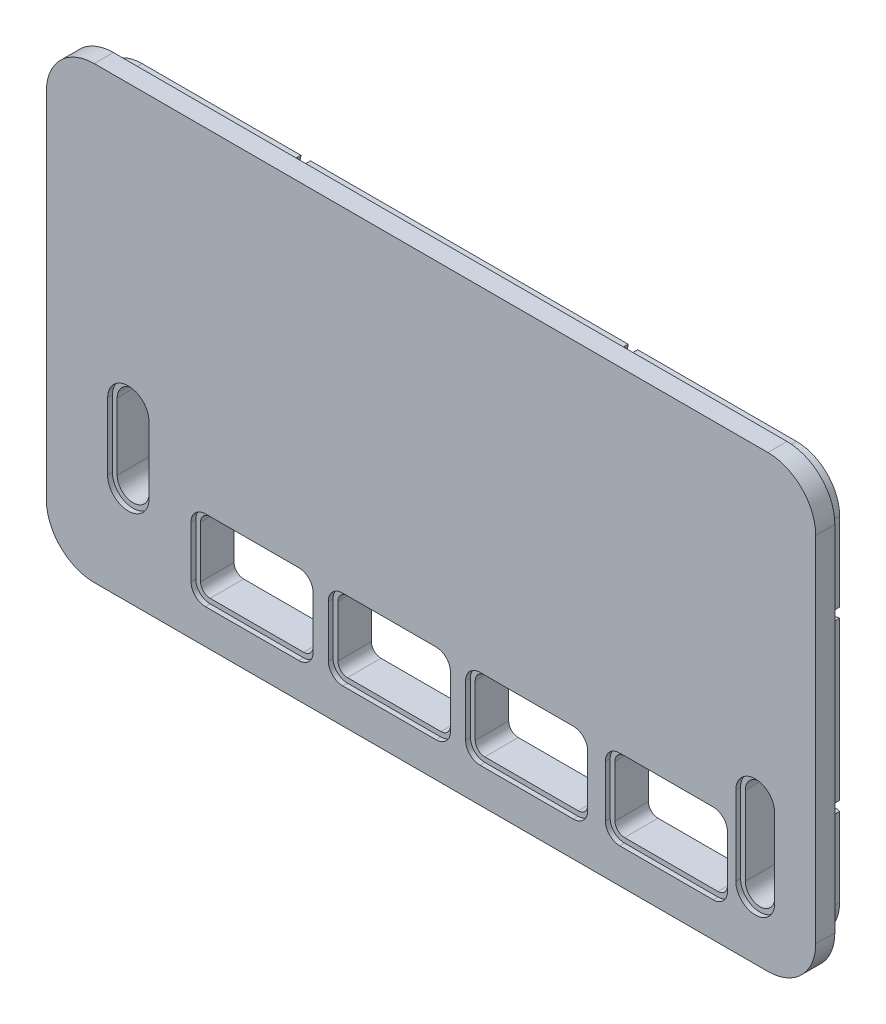
from build123d import *

# Parameters (mm, degrees)
EXTRUDE_1_DEPTH     = 2
EXTRUDE_2_DEPTH     = 2
CUT_EXTRUDE_2_DEPTH = 4
CUT_EXTRUDE_3_DEPTH = 0.5


with BuildPart() as part:
    # 草图1 → 凸台-拉伸1 (new body)
    with BuildSketch(Plane.XY.offset(994.761746566)):
        with BuildLine():
            Line((-36.977217365, -23.153037779), (-20.375793692, -23.153037779))
            ThreePointArc((-20.375793692, -23.153037779), (-20.507759703, -22.594020785), (-20.875793692, -22.153037779))
            Line((-20.875793692, -22.153037779), (-18.875793692, -22.153037779))
            ThreePointArc((-18.875793692, -22.153037779), (-19.243827681, -22.594020785), (-19.375793692, -23.153037779))
            Line((-19.375793692, -23.153037779), (13.827053654, -23.153037779))
            ThreePointArc((13.827053654, -23.153037779), (13.695087643, -22.594020785), (13.327053654, -22.153037779))
            Line((13.327053654, -22.153037779), (15.327053654, -22.153037779))
            ThreePointArc((15.327053654, -22.153037779), (14.959019666, -22.594020785), (14.827053654, -23.153037779))
            Line((14.827053654, -23.153037779), (31.428477328, -23.153037779))
            ThreePointArc((31.428477328, -23.153037779), (34.610457843, -21.835018294), (35.928477328, -18.653037779))
            Line((35.928477328, -18.653037779), (35.928477328, -10.409369377))
            ThreePointArc((35.928477328, -10.409369377), (35.356461327, -10.413320038), (35.071587729, -10.909369377))
            Line((35.071587729, -10.909369377), (35.071587729, -8.909369377))
            ThreePointArc((35.071587729, -8.909369377), (35.432427989, -9.275228629), (35.928477328, -9.409369377))
            Line((35.928477328, -9.409369377), (35.928477328, 7.077967428))
            ThreePointArc((35.928477328, 7.077967428), (35.432427989, 6.943826681), (35.071587729, 6.577967428))
            Line((35.071587729, 6.577967428), (35.071587729, 8.577967428))
            ThreePointArc((35.071587729, 8.577967428), (35.356461327, 8.08191809), (35.928477328, 8.077967428))
            Line((35.928477328, 8.077967428), (35.928477328, 16.32163583))
            ThreePointArc((35.928477328, 16.32163583), (34.610457843, 19.503616346), (31.428477328, 20.82163583))
            Line((31.428477328, 20.82163583), (14.827053654, 20.82163583))
            ThreePointArc((14.827053654, 20.82163583), (14.959019666, 20.262618836), (15.327053654, 19.82163583))
            Line((15.327053654, 19.82163583), (13.327053654, 19.82163583))
            ThreePointArc((13.327053654, 19.82163583), (13.695087643, 20.262618836), (13.827053654, 20.82163583))
            Line((13.827053654, 20.82163583), (-19.375793692, 20.82163583))
            ThreePointArc((-19.375793692, 20.82163583), (-19.243827681, 20.262618836), (-18.875793692, 19.82163583))
            Line((-18.875793692, 19.82163583), (-20.875793692, 19.82163583))
            ThreePointArc((-20.875793692, 19.82163583), (-20.507759703, 20.262618836), (-20.375793692, 20.82163583))
            Line((-20.375793692, 20.82163583), (-36.977217365, 20.82163583))
            ThreePointArc((-36.977217365, 20.82163583), (-40.15919788, 19.503616346), (-41.477217365, 16.32163583))
            Line((-41.477217365, 16.32163583), (-41.477217365, 8.077967428))
            ThreePointArc((-41.477217365, 8.077967428), (-40.905201365, 8.08191809), (-40.620327767, 8.577967428))
            Line((-40.620327767, 8.577967428), (-40.620327767, 6.577967428))
            ThreePointArc((-40.620327767, 6.577967428), (-40.981168027, 6.943826681), (-41.477217365, 7.077967428))
            Line((-41.477217365, 7.077967428), (-41.477217365, -9.409369377))
            ThreePointArc((-41.477217365, -9.409369377), (-40.981168027, -9.275228629), (-40.620327767, -8.909369377))
            Line((-40.620327767, -8.909369377), (-40.620327767, -10.909369377))
            ThreePointArc((-40.620327767, -10.909369377), (-40.905201365, -10.413320038), (-41.477217365, -10.409369377))
            Line((-41.477217365, -10.409369377), (-41.477217365, -18.653037779))
            ThreePointArc((-41.477217365, -18.653037779), (-40.15919788, -21.835018294), (-36.977217365, -23.153037779))
        make_face()
    extrude(amount=EXTRUDE_1_DEPTH)

    # 草图2 → 凸台-拉伸2 (add)
    with BuildSketch(Plane.XY.offset(996.761746566)):
        with BuildLine():
            Line((-42.977217365, 17.32163583), (-42.977217365, -19.653037779))
            ThreePointArc((-42.977217365, -19.653037779), (-41.512751271, -23.188571685), (-37.977217365, -24.653037779))
            Line((-37.977217365, -24.653037779), (32.428477328, -24.653037779))
            ThreePointArc((32.428477328, -24.653037779), (35.964011233, -23.188571685), (37.428477328, -19.653037779))
            Line((37.428477328, -19.653037779), (37.428477328, 17.32163583))
            ThreePointArc((37.428477328, 17.32163583), (35.964011233, 20.857169736), (32.428477328, 22.32163583))
            Line((32.428477328, 22.32163583), (-37.977217365, 22.32163583))
            ThreePointArc((-37.977217365, 22.32163583), (-41.512751271, 20.857169736), (-42.977217365, 17.32163583))
        make_face()
    extrude(amount=EXTRUDE_2_DEPTH)

    # 草图3 → 切除-拉伸2 (cut)
    with BuildSketch(Plane.XY.offset(998.761746566)):
        with BuildLine():
            Line((-24.489796203, -20.520829455), (-18.469872403, -20.520829455))
            Line((-18.469872403, -20.520829455), (-16.599885103, -20.520829455))
            ThreePointArc((-16.599885103, -20.520829455), (-15.892778322, -20.227936236), (-15.599885103, -19.520829455))
            Line((-15.599885103, -19.520829455), (-15.599885103, -14.120887455))
            ThreePointArc((-15.599885103, -14.120887455), (-15.892778322, -13.413780673), (-16.599885103, -13.120887455))
            Line((-16.599885103, -13.120887455), (-26.359783503, -13.120887455))
            ThreePointArc((-26.359783503, -13.120887455), (-27.066890284, -13.413780673), (-27.359783503, -14.120887455))
            Line((-27.359783503, -14.120887455), (-27.359783503, -19.520829455))
            ThreePointArc((-27.359783503, -19.520829455), (-27.066890284, -20.227936236), (-26.359783503, -20.520829455))
            Line((-26.359783503, -20.520829455), (-24.489796203, -20.520829455))
        make_face()
        with BuildLine():
            Line((-10.138767501, -20.520829455), (-4.118843701, -20.520829455))
            Line((-4.118843701, -20.520829455), (-2.248856401, -20.520829455))
            ThreePointArc((-2.248856401, -20.520829455), (-1.54174962, -20.227936236), (-1.248856401, -19.520829455))
            Line((-1.248856401, -19.520829455), (-1.248856401, -14.120887455))
            ThreePointArc((-1.248856401, -14.120887455), (-1.54174962, -13.413780673), (-2.248856401, -13.120887455))
            Line((-2.248856401, -13.120887455), (-12.008754801, -13.120887455))
            ThreePointArc((-12.008754801, -13.120887455), (-12.715861582, -13.413780673), (-13.008754801, -14.120887455))
            Line((-13.008754801, -14.120887455), (-13.008754801, -19.520829455))
            ThreePointArc((-13.008754801, -19.520829455), (-12.715861582, -20.227936236), (-12.008754801, -20.520829455))
            Line((-12.008754801, -20.520829455), (-10.138767501, -20.520829455))
        make_face()
        with BuildLine():
            Line((4.212261201, -20.520829455), (10.232185001, -20.520829455))
            Line((10.232185001, -20.520829455), (12.102172301, -20.520829455))
            ThreePointArc((12.102172301, -20.520829455), (12.809279082, -20.227936236), (13.102172301, -19.520829455))
            Line((13.102172301, -19.520829455), (13.102172301, -14.120887455))
            ThreePointArc((13.102172301, -14.120887455), (12.809279082, -13.413780673), (12.102172301, -13.120887455))
            Line((12.102172301, -13.120887455), (2.342273901, -13.120887455))
            ThreePointArc((2.342273901, -13.120887455), (1.63516712, -13.413780673), (1.342273901, -14.120887455))
            Line((1.342273901, -14.120887455), (1.342273901, -19.520829455))
            ThreePointArc((1.342273901, -19.520829455), (1.63516712, -20.227936236), (2.342273901, -20.520829455))
            Line((2.342273901, -20.520829455), (4.212261201, -20.520829455))
        make_face()
        with BuildLine():
            Line((18.817290411, -20.520829455), (24.837214211, -20.520829455))
            Line((24.837214211, -20.520829455), (26.707201511, -20.520829455))
            ThreePointArc((26.707201511, -20.520829455), (27.414308292, -20.227936236), (27.707201511, -19.520829455))
            Line((27.707201511, -19.520829455), (27.707201511, -14.120887455))
            ThreePointArc((27.707201511, -14.120887455), (27.414308292, -13.413780673), (26.707201511, -13.120887455))
            Line((26.707201511, -13.120887455), (16.947303111, -13.120887455))
            ThreePointArc((16.947303111, -13.120887455), (16.24019633, -13.413780673), (15.947303111, -14.120887455))
            Line((15.947303111, -14.120887455), (15.947303111, -19.520829455))
            ThreePointArc((15.947303111, -19.520829455), (16.24019633, -20.227936236), (16.947303111, -20.520829455))
            Line((16.947303111, -20.520829455), (18.817290411, -20.520829455))
        make_face()
        with BuildLine():
            Line((-32.745858501, -7.232593278), (-32.745858501, -14.232593278))
            ThreePointArc((-32.745858501, -14.232593278), (-34.410897833, -15.89763261), (-36.075937164, -14.232593278))
            Line((-36.075937164, -14.232593278), (-36.075937164, -7.232593278))
            ThreePointArc((-36.075937164, -7.232593278), (-34.410897833, -5.567553946), (-32.745858501, -7.232593278))
        make_face()
        with BuildLine():
            Line((32.638332298, -9.904726882), (32.638332298, -18.164726882))
            ThreePointArc((32.638332298, -18.164726882), (31.106275018, -19.696784162), (29.574217738, -18.164726882))
            Line((29.574217738, -18.164726882), (29.574217738, -9.904726882))
            ThreePointArc((29.574217738, -9.904726882), (31.106275018, -8.372669602), (32.638332298, -9.904726882))
        make_face()
    extrude(amount=-CUT_EXTRUDE_2_DEPTH, mode=Mode.SUBTRACT)

    # 草图6 → 切除-拉伸3 (cut)
    with BuildSketch(Plane.XY.offset(998.761746566)):
        with BuildLine():
            Line((-27.859783503, -14.120887455), (-27.859783503, -19.520829455))
            ThreePointArc((-27.859783503, -19.520829455), (-27.420443675, -20.581489626), (-26.359783503, -21.020829455))
            Line((-26.359783503, -21.020829455), (-16.599885103, -21.020829455))
            ThreePointArc((-16.599885103, -21.020829455), (-15.539224931, -20.581489626), (-15.099885103, -19.520829455))
            Line((-15.099885103, -19.520829455), (-15.099885103, -14.120887455))
            ThreePointArc((-15.099885103, -14.120887455), (-15.539224931, -13.060227283), (-16.599885103, -12.620887455))
            Line((-16.599885103, -12.620887455), (-26.359783503, -12.620887455))
            ThreePointArc((-26.359783503, -12.620887455), (-27.420443675, -13.060227283), (-27.859783503, -14.120887455))
        make_face()
        with BuildLine():
            Line((-0.748856401, -19.520829455), (-0.748856401, -14.120887455))
            ThreePointArc((-0.748856401, -14.120887455), (-1.188196229, -13.060227283), (-2.248856401, -12.620887455))
            Line((-2.248856401, -12.620887455), (-12.008754801, -12.620887455))
            ThreePointArc((-12.008754801, -12.620887455), (-13.069414973, -13.060227283), (-13.508754801, -14.120887455))
            Line((-13.508754801, -14.120887455), (-13.508754801, -19.520829455))
            ThreePointArc((-13.508754801, -19.520829455), (-13.069414973, -20.581489626), (-12.008754801, -21.020829455))
            Line((-12.008754801, -21.020829455), (-2.248856401, -21.020829455))
            ThreePointArc((-2.248856401, -21.020829455), (-1.188196229, -20.581489626), (-0.748856401, -19.520829455))
        make_face()
        with BuildLine():
            Line((13.602172301, -19.520829455), (13.602172301, -14.120887455))
            ThreePointArc((13.602172301, -14.120887455), (13.162832473, -13.060227283), (12.102172301, -12.620887455))
            Line((12.102172301, -12.620887455), (2.342273901, -12.620887455))
            ThreePointArc((2.342273901, -12.620887455), (1.281613729, -13.060227283), (0.842273901, -14.120887455))
            Line((0.842273901, -14.120887455), (0.842273901, -19.520829455))
            ThreePointArc((0.842273901, -19.520829455), (1.281613729, -20.581489626), (2.342273901, -21.020829455))
            Line((2.342273901, -21.020829455), (12.102172301, -21.020829455))
            ThreePointArc((12.102172301, -21.020829455), (13.162832473, -20.581489626), (13.602172301, -19.520829455))
        make_face()
        with BuildLine():
            Line((16.947303111, -21.020829455), (26.707201511, -21.020829455))
            ThreePointArc((26.707201511, -21.020829455), (27.767861683, -20.581489626), (28.207201511, -19.520829455))
            Line((28.207201511, -19.520829455), (28.207201511, -14.120887455))
            ThreePointArc((28.207201511, -14.120887455), (27.767861683, -13.060227283), (26.707201511, -12.620887455))
            Line((26.707201511, -12.620887455), (16.947303111, -12.620887455))
            ThreePointArc((16.947303111, -12.620887455), (15.886642939, -13.060227283), (15.447303111, -14.120887455))
            Line((15.447303111, -14.120887455), (15.447303111, -19.520829455))
            ThreePointArc((15.447303111, -19.520829455), (15.886642939, -20.581489626), (16.947303111, -21.020829455))
        make_face()
        with BuildLine():
            Line((-36.575937164, -7.232593278), (-36.575937164, -14.232593278))
            ThreePointArc((-36.575937164, -14.232593278), (-34.410897833, -16.39763261), (-32.245858501, -14.232593278))
            Line((-32.245858501, -14.232593278), (-32.245858501, -7.232593278))
            ThreePointArc((-32.245858501, -7.232593278), (-34.410897833, -5.067553946), (-36.575937164, -7.232593278))
        make_face()
        with BuildLine():
            Line((29.074217738, -9.904726882), (29.074217738, -18.164726882))
            ThreePointArc((29.074217738, -18.164726882), (31.106275018, -20.196784162), (33.138332298, -18.164726882))
            Line((33.138332298, -18.164726882), (33.138332298, -9.904726882))
            ThreePointArc((33.138332298, -9.904726882), (31.106275018, -7.872669602), (29.074217738, -9.904726882))
        make_face()
    extrude(amount=-CUT_EXTRUDE_3_DEPTH, mode=Mode.SUBTRACT)


solid = part.part
